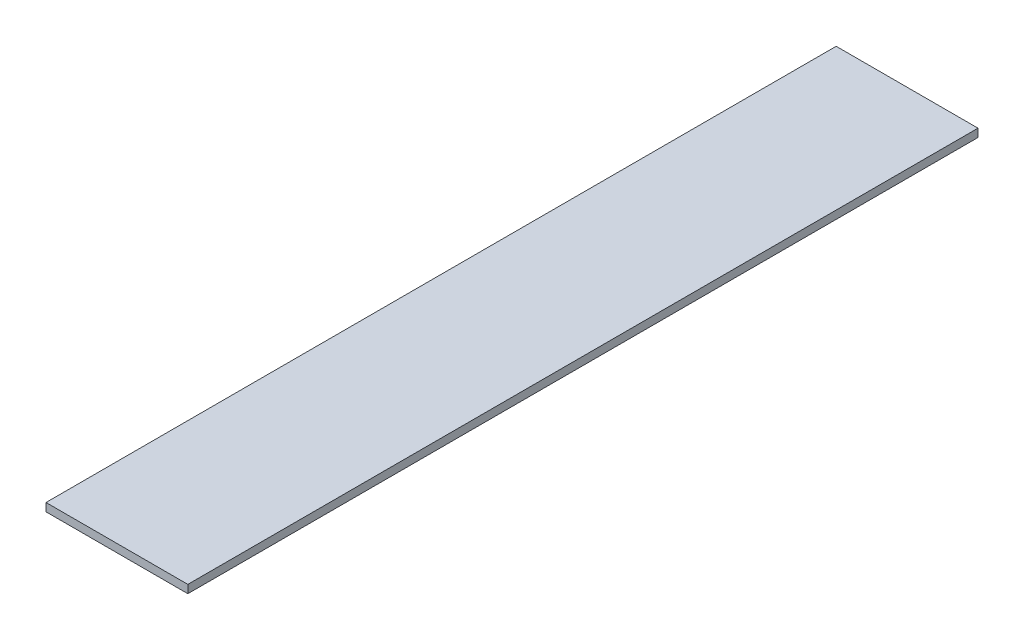
from build123d import *

# Parameters (mm, degrees)
SKETCH1_W           = 35
SKETCH1_H           = 195
BOSS_EXTRUDE1_DEPTH = 2


with BuildPart() as part:
    # Sketch1 → Boss-Extrude1 (new body)
    with BuildSketch(Plane(origin=(0, 0, 0), x_dir=(1, 0, 0), z_dir=(0, 1, 0))):
        with Locations((17.5, 97.5)):
            Rectangle(SKETCH1_W, SKETCH1_H)
    extrude(amount=BOSS_EXTRUDE1_DEPTH)


solid = part.part
